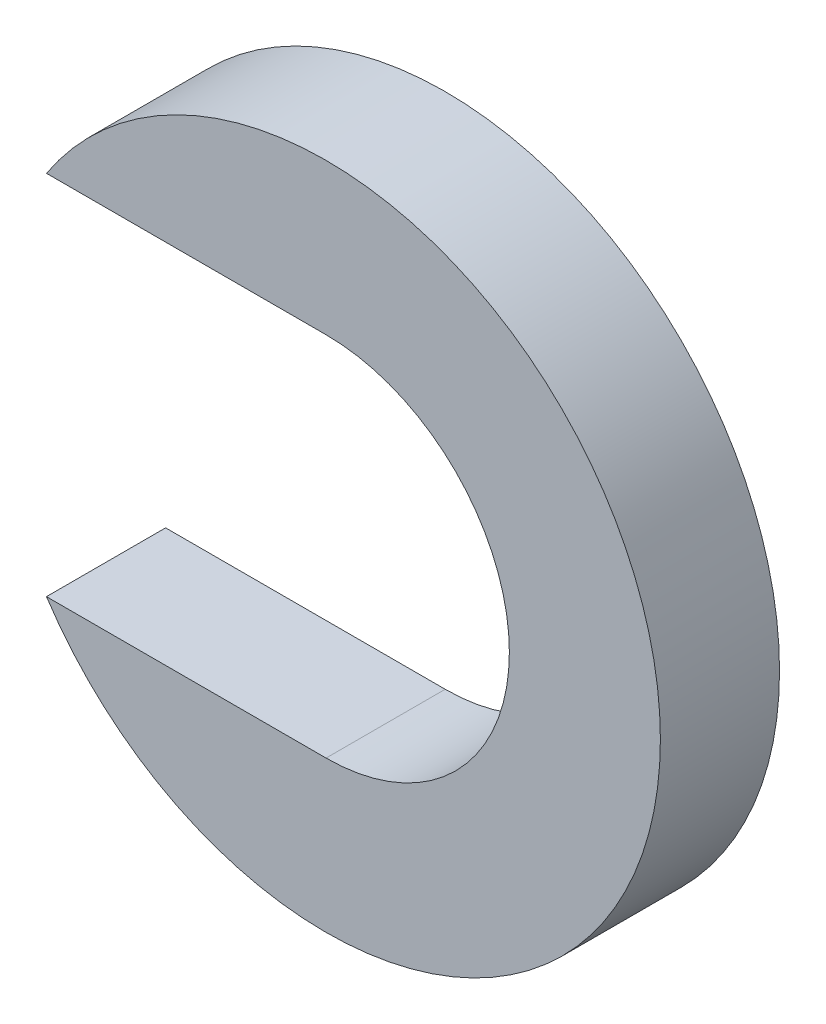
from build123d import *

# Parameters (mm, degrees)
SALIENTE_EXTRUIR1_DEPTH = 3.25


with BuildPart() as part:
    # Croquis1 → Saliente-Extruir1 (new body)
    with BuildSketch(Plane.XY):
        with BuildLine():
            ThreePointArc((-7.627214433, -5), (9.12, 0), (-7.627214433, 5))
            Line((-7.627214433, 5), (0, 5))
            ThreePointArc((0, 5), (5, 0), (0, -5))
            Line((0, -5), (-7.627214433, -5))
        make_face()
    extrude(amount=SALIENTE_EXTRUIR1_DEPTH)


solid = part.part
